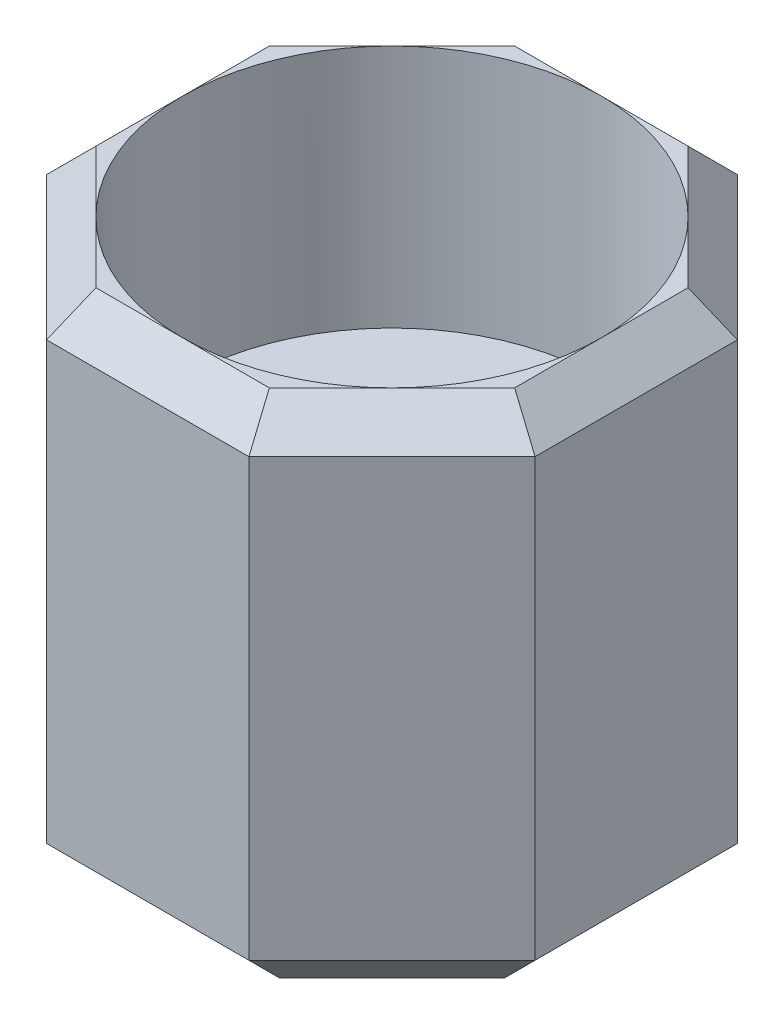
from build123d import *

# Parameters (mm, degrees)
EXTRUDE_1_DEPTH     = 15
CHAMFER_1_SIZE      = 1
CHAMFER_2_SIZE      = 1.5
SKETCH_2_R          = 6
CUT_EXTRUDE_1_DEPTH = 7
SKETCH_3_R          = 3.5
CUT_EXTRUDE_2_DEPTH = 4.5
SKETCH_4_R          = 1
CUT_EXTRUDE_3_DEPTH = 1.5
CHAMFER_5_SIZE      = 1


with BuildPart() as part:
    # Эскиз1 → Бобышка-Вытянуть1 (new body)
    with BuildSketch(Plane(origin=(0, 0, 0), x_dir=(1, 0, 0), z_dir=(0, 1, 0))):
        Polygon((-2.899494937, 7), (-7, 2.899494937), (-7, -2.899494937), (-2.899494937, -7), (2.899494937, -7), (7, -2.899494937), (7, 2.899494937), (2.899494937, 7), align=None)
    extrude(amount=EXTRUDE_1_DEPTH)

    # Фаска1
    chamfer_1_edges = [part.edges().sort_by_distance(p)[0] for p in [
        (-4.949747468, 15, -4.949747468),
        (-7, 15, 0),
        (-4.949747468, 15, 4.949747468),
        (0, 15, 7),
        (4.949747468, 15, 4.949747468),
        (7, 15, 0),
        (4.949747468, 15, -4.949747468),
        (0, 15, -7),
    ]]
    chamfer(chamfer_1_edges, length=CHAMFER_1_SIZE)

    # Фаска2
    chamfer_2_edges = [part.edges().sort_by_distance(p)[0] for p in [
        (-4.949747468, 0, 4.949747468),
        (-7, 0, 0),
        (-4.949747468, 0, -4.949747468),
        (0, 0, -7),
        (4.949747468, 0, -4.949747468),
        (7, 0, 0),
        (4.949747468, 0, 4.949747468),
        (0, 0, 7),
    ]]
    chamfer(chamfer_2_edges, length=CHAMFER_2_SIZE)

    # Эскиз2 → Вырез-Вытянуть1 (cut)
    with BuildSketch(Plane(origin=(0, 15, 0), x_dir=(1, 0, 0), z_dir=(0, 1, 0))):
        with Locations(Location((0, 0, 0), (0, 0, 270))):
            Circle(SKETCH_2_R)
    extrude(amount=-CUT_EXTRUDE_1_DEPTH, mode=Mode.SUBTRACT)

    # Эскиз3 → Вырез-Вытянуть2 (cut)
    with BuildSketch(Plane.XZ):
        with Locations(Location((0, 0, 0), (0, 0, 270))):
            Circle(SKETCH_3_R)
    extrude(amount=-CUT_EXTRUDE_2_DEPTH, mode=Mode.SUBTRACT)

    # Эскиз4 → Вырез-Вытянуть3 (cut)
    with BuildSketch(Plane.XZ.offset(-4.5)):
        with Locations(Location((0, 0, 0), (0, 0, 270))):
            Circle(SKETCH_4_R)
    extrude(amount=-CUT_EXTRUDE_3_DEPTH, mode=Mode.SUBTRACT)

    # Фаска5
    chamfer_5_edges = [part.edges().sort_by_distance(p)[0] for p in [
        (0, 6, 1),
    ]]
    chamfer(chamfer_5_edges, length=CHAMFER_5_SIZE)


solid = part.part
